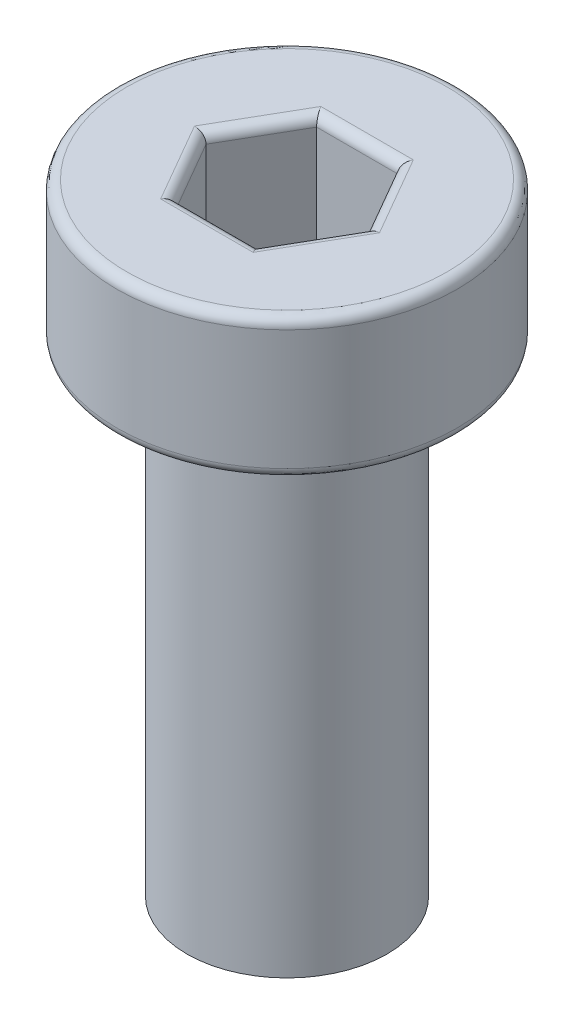
from build123d import *

# Parameters (mm, degrees)
CUT_EXTRUDE1_DEPTH = 3
FILLET1_R          = 0.25


with BuildPart() as part:
    # Sketch2 → Revolve1 (revolve)
    with BuildSketch(Plane.XY, mode=Mode.PRIVATE) as revolve1_sk:
        Polygon((0, 3.5), (4.25, 3.5), (4.25, 0), (2.5, 0), (2.5, -12), (0, -12), align=None)
    revolve(revolve1_sk.sketch.rotate(Axis((0, 21.322324325, 0), (0, -1, 0)), 180), axis=Axis((0, 21.322324325, 0), (0, -1, 0)))

    # Sketch3 → Cut-Extrude1 (cut)
    with BuildSketch(Plane(origin=(0, 3.5, 0), x_dir=(1, 0, 0), z_dir=(0, 1, 0))):
        Polygon((2.020725942, 0), (1.010362971, 1.75), (-1.010362971, 1.75), (-2.020725942, 0), (-1.010362971, -1.75), (1.010362971, -1.75), align=None)
    extrude(amount=-CUT_EXTRUDE1_DEPTH, mode=Mode.SUBTRACT)

    # Fillet1
    fillet1_edges = [part.edges().sort_by_distance(p)[0] for p in [
        (1.515544457, 3.5, 0.875),
        (1.515544457, 3.5, -0.875),
        (0, 3.5, -1.75),
        (-1.515544457, 3.5, -0.875),
        (-1.515544457, 3.5, 0.875),
        (0, 3.5, 1.75),
        (2.5, 0, 0),
        (4.25, 0, 0),
        (4.25, 3.5, 0),
    ]]
    fillet(fillet1_edges, radius=FILLET1_R)


solid = part.part
